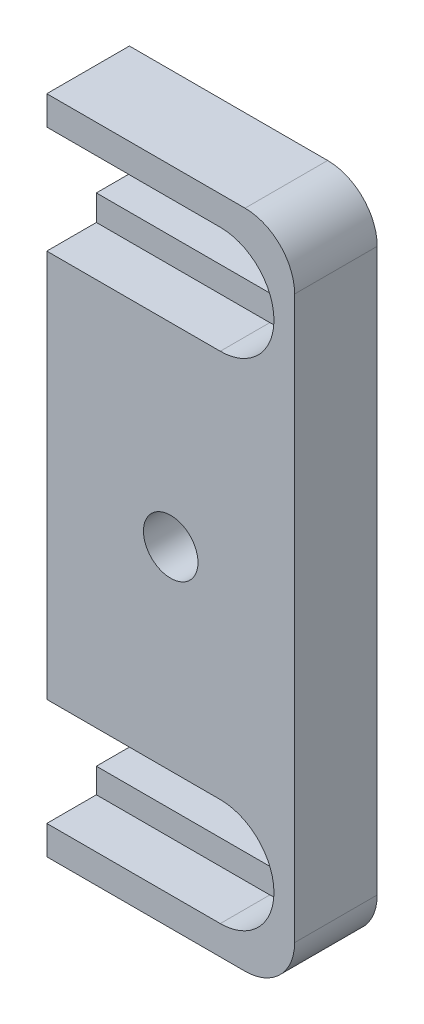
from build123d import *

# Parameters (mm, degrees)
SKETCH1_W             = 15
SKETCH1_H             = 40
BOSS_EXTRUDE1_DEPTH   = 5
CUT_EXTRUDE1_DEPTH    = 3
CUT_EXTRUDE2_DEPTH    = 43.825226211
CUT_EXTRUDE3_DEPTH    = 3
CUT_EXTRUDE4_DEPTH    = 44.011626335
F_4_CLEARANCE_HOLE1_D = 3.3
FILLET1_R             = 3


with BuildPart() as part:
    # Sketch1 → Boss-Extrude1 (new body)
    with BuildSketch(Plane.XY.offset(5)):
        with Locations((7.5, -20)):
            Rectangle(SKETCH1_W, SKETCH1_H)
    extrude(amount=-BOSS_EXTRUDE1_DEPTH)

    # Sketch2 → Cut-Extrude1 (cut)
    with BuildSketch(Plane.XY.offset(5)):
        with BuildLine():
            Line((0, -8.25), (10.5, -8.25))
            ThreePointArc((10.5, -8.25), (13.75, -5), (10.5, -1.75))
            Line((10.5, -1.75), (0, -1.75))
            Line((0, -1.75), (0, -8.25))
        make_face()
    extrude(amount=-CUT_EXTRUDE1_DEPTH, mode=Mode.SUBTRACT)

    # Sketch3 → Cut-Extrude2 (cut, through all)
    with BuildSketch(Plane.XY.offset(2)):
        with BuildLine():
            Line((0, -3.3), (0, -6.7))
            Line((0, -6.7), (10.5, -6.7))
            ThreePointArc((10.5, -6.7), (12.2, -5), (10.5, -3.3))
            Line((10.5, -3.3), (0, -3.3))
        make_face()
    extrude(amount=-CUT_EXTRUDE2_DEPTH, mode=Mode.SUBTRACT)

    # Sketch4 → Cut-Extrude3 (cut)
    with BuildSketch(Plane.XY.offset(5)):
        with BuildLine():
            Line((0, -38.25), (10.5, -38.25))
            ThreePointArc((10.5, -38.25), (13.75, -35), (10.5, -31.75))
            Line((10.5, -31.75), (0, -31.75))
            Line((0, -31.75), (0, -38.25))
        make_face()
    extrude(amount=-CUT_EXTRUDE3_DEPTH, mode=Mode.SUBTRACT)

    # Sketch5 → Cut-Extrude4 (cut, through all)
    with BuildSketch(Plane(origin=(0, 0, 0), x_dir=(-1, 0, 0), z_dir=(0, 0, -1))):
        with BuildLine():
            Line((0, -36.75), (0, -33.25))
            Line((0, -33.25), (-10.5, -33.25))
            ThreePointArc((-10.5, -33.25), (-12.25, -35), (-10.5, -36.75))
            Line((-10.5, -36.75), (0, -36.75))
        make_face()
    extrude(amount=-CUT_EXTRUDE4_DEPTH, mode=Mode.SUBTRACT)

    # #4 Clearance Hole1 (through all)
    with Locations(Plane.XY.offset(5)):
        with Locations((7.5, -20)):
            Hole(F_4_CLEARANCE_HOLE1_D / 2)

    # Fillet1
    fillet1_edges = [part.edges().sort_by_distance(p)[0] for p in [
        (15, -40, 2.5),
        (15, 0, 2.5),
    ]]
    fillet(fillet1_edges, radius=FILLET1_R)


solid = part.part
